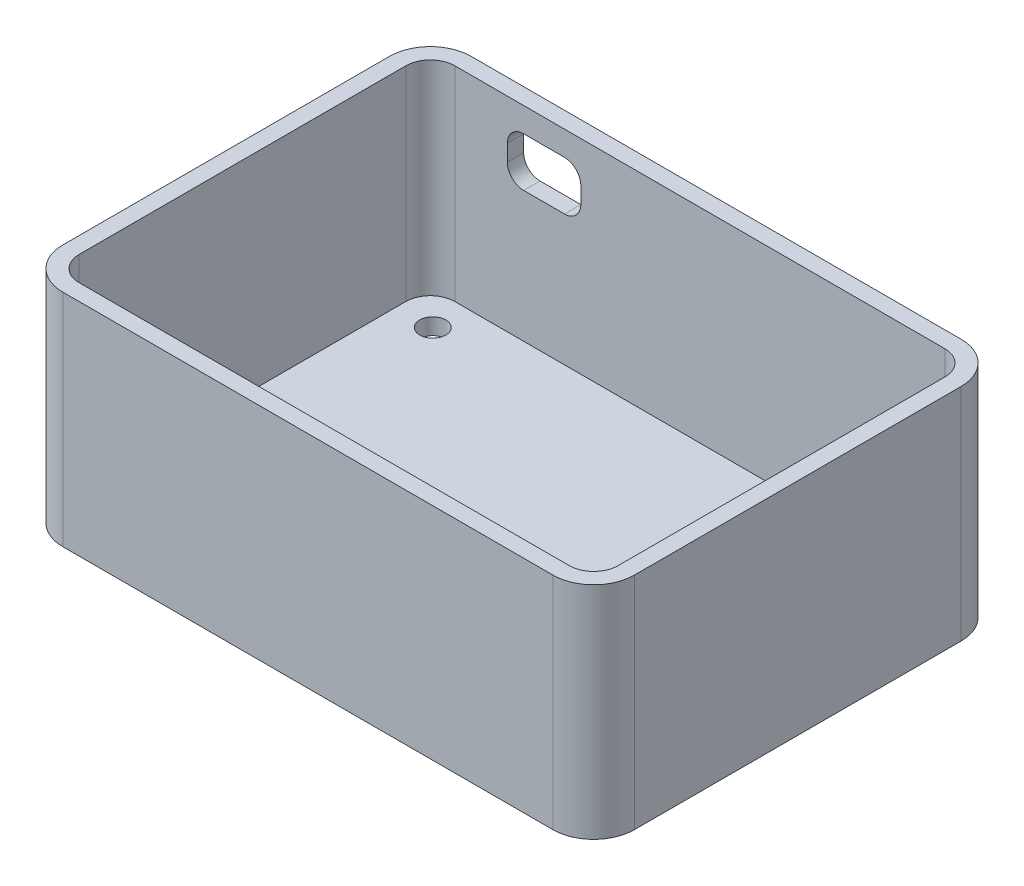
from build123d import *

# Parameters (mm, degrees)
SKETCH1_R           = 1.6
BOSS_EXTRUDE2_DEPTH = 2
BOSS_EXTRUDE3_DEPTH = 25
CUT_EXTRUDE1_REACH  = 92.161


with BuildPart() as part:
    # Sketch1 → Boss-Extrude2 (new body)
    with BuildSketch(Plane(origin=(0, 0, 0), x_dir=(1, 0, 0), z_dir=(0, 1, 0))):
        with BuildLine():
            Line((5, 0), (65, 0))
            ThreePointArc((65, 0), (68.535533906, -1.464466094), (70, -5))
            Line((70, -5), (70, -45))
            ThreePointArc((70, -45), (68.535533906, -48.535533906), (65, -50))
            Line((65, -50), (5, -50))
            ThreePointArc((5, -50), (1.464466094, -48.535533906), (0, -45))
            Line((0, -45), (0, -5))
            ThreePointArc((0, -5), (1.464466094, -1.464466094), (5, 0))
        make_face()
        with Locations(Location((6.4, -6.1, 0), (0, 0, 270))):
            Circle(SKETCH1_R, mode=Mode.SUBTRACT)
        with Locations(Location((63.6, -6.1, 0), (0, 0, 270))):
            Circle(SKETCH1_R, mode=Mode.SUBTRACT)
        with Locations(Location((6.4, -43.9, 0), (0, 0, 270))):
            Circle(SKETCH1_R, mode=Mode.SUBTRACT)
        with Locations(Location((63.6, -43.9, 0), (0, 0, 270))):
            Circle(SKETCH1_R, mode=Mode.SUBTRACT)
    extrude(amount=BOSS_EXTRUDE2_DEPTH)

    # Sketch2 → Boss-Extrude3 (add)
    with BuildSketch(Plane(origin=(0, 2, 0), x_dir=(1, 0, 0), z_dir=(0, 1, 0))):
        with BuildLine():
            Line((5, 0), (65, 0))
            ThreePointArc((65, 0), (68.535533906, -1.464466094), (70, -5))
            Line((70, -5), (70, -45))
            ThreePointArc((70, -45), (68.535533906, -48.535533906), (65, -50))
            Line((65, -50), (5, -50))
            ThreePointArc((5, -50), (1.464466094, -48.535533906), (0, -45))
            Line((0, -45), (0, -5))
            ThreePointArc((0, -5), (1.464466094, -1.464466094), (5, 0))
        make_face()
        with BuildLine():
            Line((2, -5), (2, -45))
            ThreePointArc((2, -45), (2.878679656, -47.121320344), (5, -48))
            Line((5, -48), (65, -48))
            ThreePointArc((65, -48), (67.121320344, -47.121320344), (68, -45))
            Line((68, -45), (68, -5))
            ThreePointArc((68, -5), (67.121320344, -2.878679656), (65, -2))
            Line((65, -2), (5, -2))
            ThreePointArc((5, -2), (2.878679656, -2.878679656), (2, -5))
        make_face(mode=Mode.SUBTRACT)
    extrude(amount=BOSS_EXTRUDE3_DEPTH)

    # Sketch3 → Cut-Extrude1 (cut, up to next)
    with BuildSketch(Plane(origin=(0, 0, 0), x_dir=(-1, 0, 0), z_dir=(0, 0, -1)), mode=Mode.PRIVATE) as cut_extrude1_sk1:
        with BuildLine():
            Line((-13.428689643, 24), (-18.428689643, 24))
            ThreePointArc((-18.428689643, 24), (-19.842903206, 23.414213562), (-20.428689643, 22))
            Line((-20.428689643, 22), (-20.428689643, 20))
            ThreePointArc((-20.428689643, 20), (-19.842903206, 18.585786438), (-18.428689643, 18))
            Line((-18.428689643, 18), (-13.428689643, 18))
            ThreePointArc((-13.428689643, 18), (-12.014476081, 18.585786438), (-11.428689643, 20))
            Line((-11.428689643, 20), (-11.428689643, 22))
            ThreePointArc((-11.428689643, 22), (-12.014476081, 23.414213562), (-13.428689643, 24))
        make_face()
    cut_extrude1_tool1 = extrude(cut_extrude1_sk1.sketch, amount=-CUT_EXTRUDE1_REACH, mode=Mode.PRIVATE) & part.part
    add(cut_extrude1_tool1.solids().sort_by_distance((15.92869, 21, 0))[0], mode=Mode.SUBTRACT)


solid = part.part
